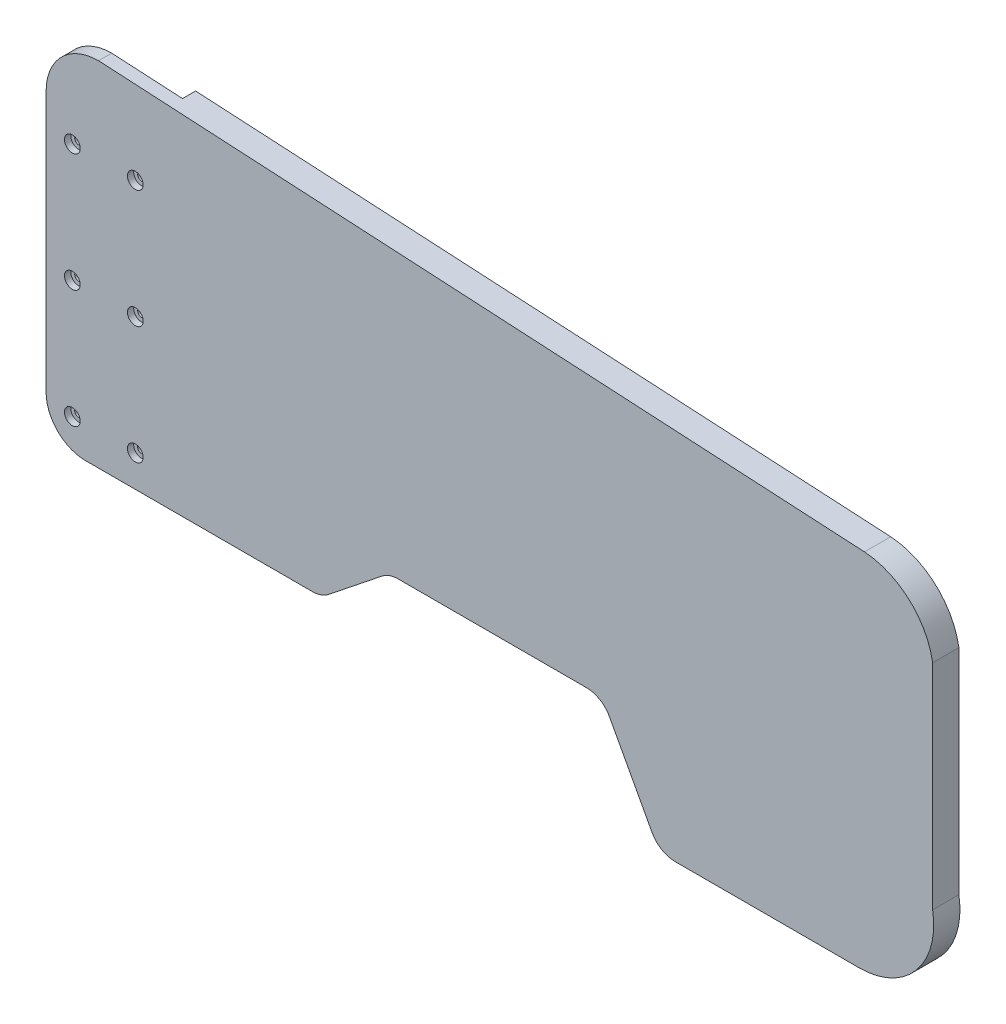
from build123d import *

# Parameters (mm, degrees)
DODANIE_WYCI_GNI_CIE1_DEPTH = 5
SZKIC1_R                    = 3.5
WYTNIJ_WYCI_GNI_CIE1_DEPTH  = 88.4
SZKIC3_R                    = 1.5
WYTNIJ_WYCI_GNI_CIE3_DEPTH  = 5
SZKIC5_R                    = 3
WYTNIJ_WYCI_GNI_CIE4_DEPTH  = 2.4
DODANIE_WYCI_GNI_CIE2_START = 5
DODANIE_WYCI_GNI_CIE2_DEPTH = 5
SZKIC7_R                    = 3.5
WYTNIJ_WYCI_GNI_CIE5_DEPTH  = 5
SZKIC8_R                    = 3.5
WYTNIJ_WYCI_GNI_CIE6_DEPTH  = 5
SZKIC9_R                    = 1.5
WYTNIJ_WYCI_GNI_CIE7_DEPTH  = 3
SZKIC10_R                   = 2.85
WYTNIJ_WYCI_GNI_CIE8_DEPTH  = 2
SZKIC11_W                   = 7
SZKIC11_H                   = 5
WYTNIJ_WYCI_GNI_CIE9_DEPTH  = 3.5


with BuildPart() as part:
    # outer-wire → Dodanie-wyciągnięcie1 (new body)
    with BuildSketch(Plane.XY):
        with BuildLine():
            Line((-24, -24.53020641), (62.5, -24.53020641))
            ThreePointArc((62.5, -24.53020641), (65.803504247, -23.968789974), (68.736080178, -22.347578348))
            Line((68.736080178, -22.347578348), (89, -6.182628062))
            ThreePointArc((89, -6.182628062), (91.932575931, -4.561416436), (95.236080178, -4))
            Line((95.236080178, -4), (167, -4))
            ThreePointArc((167, -4), (172.310885546, -5.526836794), (176, -9.641101056))
            Line((176, -9.641101056), (192, -39.280484771))
            ThreePointArc((192, -39.280484771), (195.676368139, -43.118069462), (200.799707694, -44.53020641))
            Line((200.799707694, -44.53020641), (271, -44.53020641))
            ThreePointArc((271, -44.53020641), (292.697243682, -34.454979346), (299, -11.3778078))
            Line((299, -11.3778078), (299, 70.236479581))
            ThreePointArc((299, 70.236479581), (290.082226047, 86.530998263), (273, 93.827270232))
            Line((273, 93.827270232), (-19, 110))
            ThreePointArc((-19, 110), (-33.142135624, 104.142135624), (-39, 90))
            Line((-39, 90), (-39, -9.53020641))
            ThreePointArc((-39, -9.53020641), (-34.606601718, -20.136808128), (-24, -24.53020641))
        make_face()
    extrude(amount=DODANIE_WYCI_GNI_CIE1_DEPTH)

    # Szkic1 → Wytnij-wyciągnięcie1 (cut)
    with BuildSketch(Plane(origin=(0, -24.53020641, 0), x_dir=(-1, 0, 0), z_dir=(0, -1, 0))):
        with Locations((19, 0)):
            Circle(SZKIC1_R)
    extrude(amount=-WYTNIJ_WYCI_GNI_CIE1_DEPTH, mode=Mode.SUBTRACT)

    # Szkic3 → Wytnij-wyciągnięcie3 (cut)
    with BuildSketch(Plane.XY.offset(5)):
        with Locations((-5, 77.5)):
            Circle(SZKIC3_R)
        with Locations((-29, 77.5)):
            Circle(SZKIC3_R)
        with Locations((-29, -12.5)):
            Circle(SZKIC3_R)
        with Locations((-29, 32.5)):
            Circle(SZKIC3_R)
        with Locations((-5, 32.5)):
            Circle(SZKIC3_R)
        with Locations((-5, -12.5)):
            Circle(SZKIC3_R)
    extrude(amount=-WYTNIJ_WYCI_GNI_CIE3_DEPTH, mode=Mode.SUBTRACT)

    # Szkic5 → Wytnij-wyciągnięcie4 (cut)
    with BuildSketch(Plane.XY.offset(5)):
        with Locations((-29, -12.5)):
            Circle(SZKIC5_R)
        with Locations((-29, 32.5)):
            Circle(SZKIC5_R)
        with Locations((-29, 77.5)):
            Circle(SZKIC5_R)
        with Locations((-5, 77.5)):
            Circle(SZKIC5_R)
        with Locations((-5, 32.5)):
            Circle(SZKIC5_R)
        with Locations((-5, -12.5)):
            Circle(SZKIC5_R)
    extrude(amount=-WYTNIJ_WYCI_GNI_CIE4_DEPTH, mode=Mode.SUBTRACT)

    # Szkic6 → Dodanie-wyciągnięcie2 (add)
    with BuildSketch(Plane(origin=(0, 0, 0), x_dir=(-1, 0, 0), z_dir=(0, 0, -1)).offset(DODANIE_WYCI_GNI_CIE2_START)):
        with BuildLine():
            Line((-8, -24.53020641), (-8, 108.504576357))
            Line((-8, 108.504576357), (-273, 93.827270232))
            ThreePointArc((-273, 93.827270232), (-290.082226047, 86.530998263), (-299, 70.236479581))
            Line((-299, 70.236479581), (-299, -11.3778078))
            ThreePointArc((-299, -11.3778078), (-292.697243682, -34.454979346), (-271, -44.53020641))
            Line((-271, -44.53020641), (-200.799707694, -44.53020641))
            ThreePointArc((-200.799707694, -44.53020641), (-195.676368139, -43.118069462), (-192, -39.280484771))
            Line((-192, -39.280484771), (-176, -9.641101056))
            ThreePointArc((-176, -9.641101056), (-172.310885546, -5.526836794), (-167, -4))
            Line((-167, -4), (-95.236080178, -4))
            ThreePointArc((-95.236080178, -4), (-91.932575931, -4.561416436), (-89, -6.182628062))
            Line((-89, -6.182628062), (-68.736080178, -22.347578348))
            ThreePointArc((-68.736080178, -22.347578348), (-65.803504247, -23.968789974), (-62.5, -24.53020641))
            Line((-62.5, -24.53020641), (-8, -24.53020641))
        make_face()
    extrude(amount=-DODANIE_WYCI_GNI_CIE2_DEPTH)

    # Szkic7 → Wytnij-wyciągnięcie5 (cut)
    with BuildSketch(Plane(origin=(0, 65.36979359, 0), x_dir=(-1, 0, 0), z_dir=(0, -1, 0))):
        with Locations((19, 0)):
            Circle(SZKIC7_R)
    extrude(amount=-WYTNIJ_WYCI_GNI_CIE5_DEPTH, mode=Mode.SUBTRACT)

    # Szkic8 → Wytnij-wyciągnięcie6 (cut)
    with BuildSketch(Plane(origin=(0, 73.36979359, 0), x_dir=(-1, 0, 0), z_dir=(0, -1, 0))):
        with Locations((19, 0)):
            Circle(SZKIC8_R)
    extrude(amount=-WYTNIJ_WYCI_GNI_CIE6_DEPTH, mode=Mode.SUBTRACT)

    # Szkic9 → Wytnij-wyciągnięcie7 (cut)
    with BuildSketch(Plane(origin=(0, 73.36979359, 0), x_dir=(-1, 0, 0), z_dir=(0, -1, 0))):
        with Locations((19, 0)):
            Circle(SZKIC9_R)
    extrude(amount=WYTNIJ_WYCI_GNI_CIE7_DEPTH, mode=Mode.SUBTRACT)

    # Szkic10 → Wytnij-wyciągnięcie8 (cut)
    with BuildSketch(Plane(origin=(0, 65.36979359, 0), x_dir=(-1, 0, 0), z_dir=(0, -1, 0))):
        with Locations((19, 0)):
            Circle(SZKIC10_R)
    extrude(amount=WYTNIJ_WYCI_GNI_CIE8_DEPTH, mode=Mode.SUBTRACT)

    # Szkic11 → Wytnij-wyciągnięcie9 (cut)
    with BuildSketch(Plane(origin=(0, 0, 0), x_dir=(-1, 0, 0), z_dir=(0, 0, -1))):
        with Locations((19, 75.86979359)):
            Rectangle(SZKIC11_W, SZKIC11_H)
        with Locations((19, 67.86979359)):
            Rectangle(SZKIC11_W, SZKIC11_H)
    extrude(amount=-WYTNIJ_WYCI_GNI_CIE9_DEPTH, mode=Mode.SUBTRACT)


solid = part.part
